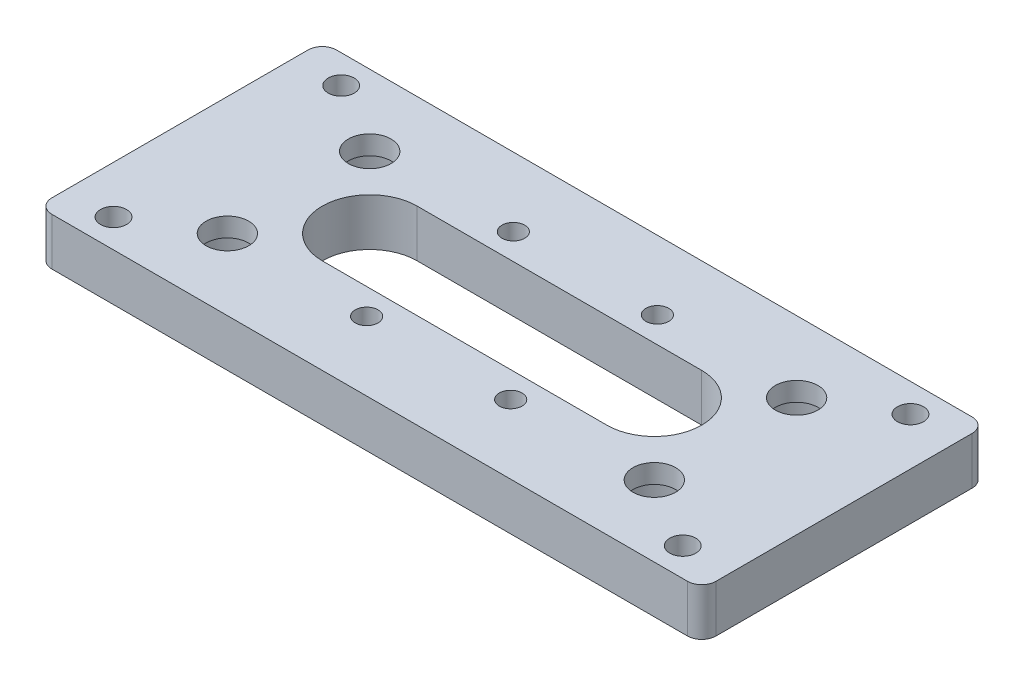
from build123d import *

# Parameters (mm, degrees)
SKETCH1_R                  = 2.75
SKETCH1_W                  = 130
SKETCH1_H                  = 38
BOSS_EXTRUDE1_DEPTH        = 10
SKETCH1_2_W                = 130
SKETCH1_2_H                = 38
BOSS_EXTRUDE2_DEPTH        = 10
M3_5_CLEARANCE_HOLE1_D     = 4.8
M3_5_CLEARANCE_HOLE1_DEPTH = 8
M3_5_CLEARANCE_HOLE1_TIP   = 1.442065486
CUT_EXTRUDE1_DEPTH         = 10
M16_CLEARANCE_HOLE1_D      = 19
M16_CLEARANCE_HOLE1_DEPTH  = 6
M8_CLEARANCE_HOLE1_D       = 9


with BuildPart() as part:
    # Sketch1 → Boss-Extrude1 (new body)
    with BuildSketch(Plane(origin=(0, 0, 0), x_dir=(1, 0, 0), z_dir=(0, 1, 0))):
        with BuildLine():
            Line((67, 30), (-67, 30))
            ThreePointArc((-67, 30), (-69.121320344, 29.121320344), (-70, 27))
            Line((-70, 27), (-70, -27))
            ThreePointArc((-70, -27), (-69.121320344, -29.121320344), (-67, -30))
            Line((-67, -30), (67, -30))
            ThreePointArc((67, -30), (69.121320344, -29.121320344), (70, -27))
            Line((70, -27), (70, 27))
            ThreePointArc((70, 27), (69.121320344, 29.121320344), (67, 30))
        make_face()
        with Locations(Location((-60, 24, 0), (0, 0, 270))):
            Circle(SKETCH1_R, mode=Mode.SUBTRACT)
        with Locations(Location((-60, -24, 0), (0, 0, 270))):
            Circle(SKETCH1_R, mode=Mode.SUBTRACT)
        with Locations(Location((60, -24, 0), (0, 0, 270))):
            Circle(SKETCH1_R, mode=Mode.SUBTRACT)
        with Locations(Location((60, 24, 0), (0, 0, 270))):
            Circle(SKETCH1_R, mode=Mode.SUBTRACT)
        Rectangle(SKETCH1_W, SKETCH1_H, mode=Mode.SUBTRACT)
    extrude(amount=BOSS_EXTRUDE1_DEPTH)

    # Sketch1<2> → Boss-Extrude2 (add)
    with BuildSketch(Plane(origin=(0, 0, 0), x_dir=(1, 0, 0), z_dir=(0, 1, 0))):
        Rectangle(SKETCH1_2_W, SKETCH1_2_H)
    extrude(amount=BOSS_EXTRUDE2_DEPTH)

    # M3.5 Clearance Hole1
    with Locations(Plane(origin=(0, 10, 0), x_dir=(1, 0, 0), z_dir=(0, 1, 0))):
        with Locations((0, 0), (-15.181752664, -15.463217926), (15.181752664, 15.463217926), (15.181752664, -15.463217926), (-15.181752664, 15.463217926)):
            Hole(M3_5_CLEARANCE_HOLE1_D / 2, depth=M3_5_CLEARANCE_HOLE1_DEPTH)
            with Locations((0, 0, -(M3_5_CLEARANCE_HOLE1_DEPTH + M3_5_CLEARANCE_HOLE1_TIP / 2))):  # 118° drill point
                Cone(0, M3_5_CLEARANCE_HOLE1_D / 2, M3_5_CLEARANCE_HOLE1_TIP, mode=Mode.SUBTRACT)

    # Sketch6 → Cut-Extrude1 (cut)
    with BuildSketch(Plane(origin=(0, 10, 0), x_dir=(1, 0, 0), z_dir=(0, 1, 0))):
        with BuildLine():
            Line((-30, 10), (30, 10))
            ThreePointArc((30, 10), (40, 0), (30, -10))
            Line((30, -10), (-30, -10))
            ThreePointArc((-30, -10), (-40, 0), (-30, 10))
        make_face()
    extrude(amount=-CUT_EXTRUDE1_DEPTH, mode=Mode.SUBTRACT)

    # M16 Clearance Hole1
    with Locations(Plane(origin=(0, 0, 0), x_dir=(-1, 0, 0), z_dir=(0, -1, 0))):
        with Locations((0, 0), (-45, -15), (45, 15), (45, -15), (-45, 15)):
            Hole(M16_CLEARANCE_HOLE1_D / 2, depth=M16_CLEARANCE_HOLE1_DEPTH)

    # M8 Clearance Hole1 (through all)
    with Locations(Plane(origin=(0, 0, 0), x_dir=(-1, 0, 0), z_dir=(0, -1, 0))):
        with Locations((45, -15), (45, 15), (-45, 15), (-45, -15)):
            Hole(M8_CLEARANCE_HOLE1_D / 2)


solid = part.part
